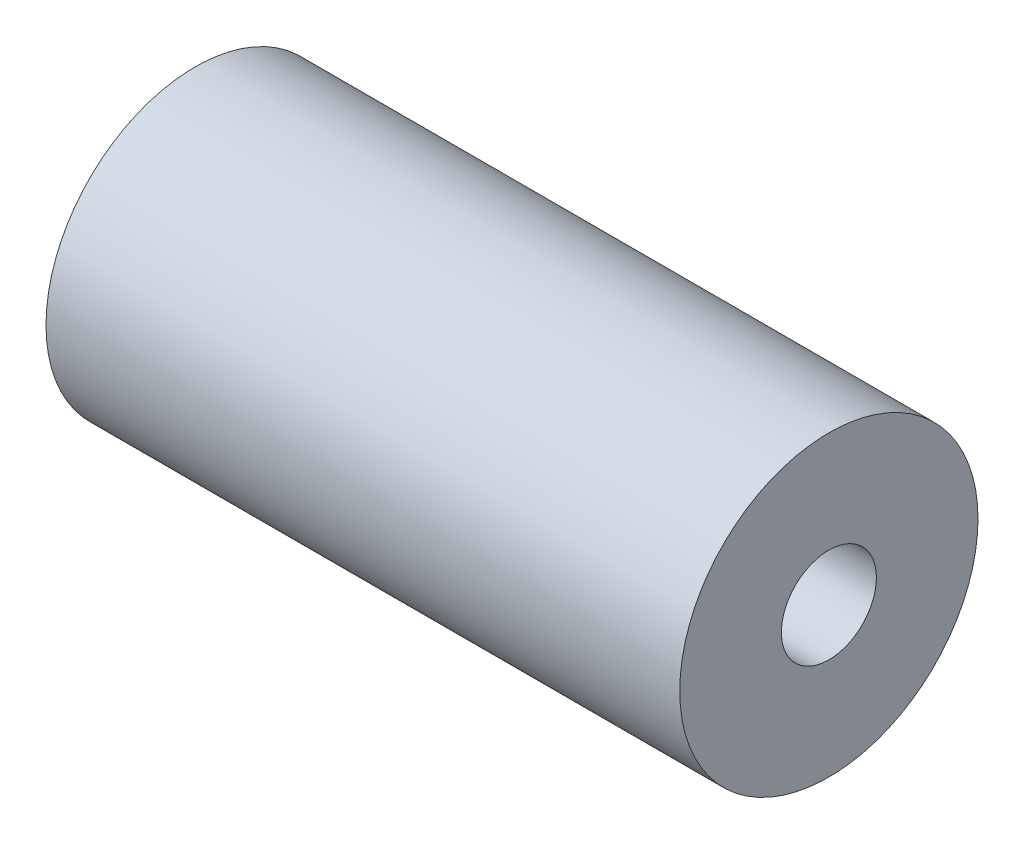
from build123d import *

# Parameters (mm, degrees)
SKETCH1_R           = 8
SKETCH1_R_2         = 2.55
BOSS_EXTRUDE1_DEPTH = 34


with BuildPart() as part:
    # Sketch1 → Boss-Extrude1 (new body)
    with BuildSketch(Plane(origin=(0, 0, 0), x_dir=(0, 0, -1), z_dir=(1, 0, 0))):
        Circle(SKETCH1_R)
        Circle(SKETCH1_R_2, mode=Mode.SUBTRACT)
    extrude(amount=BOSS_EXTRUDE1_DEPTH)


solid = part.part
